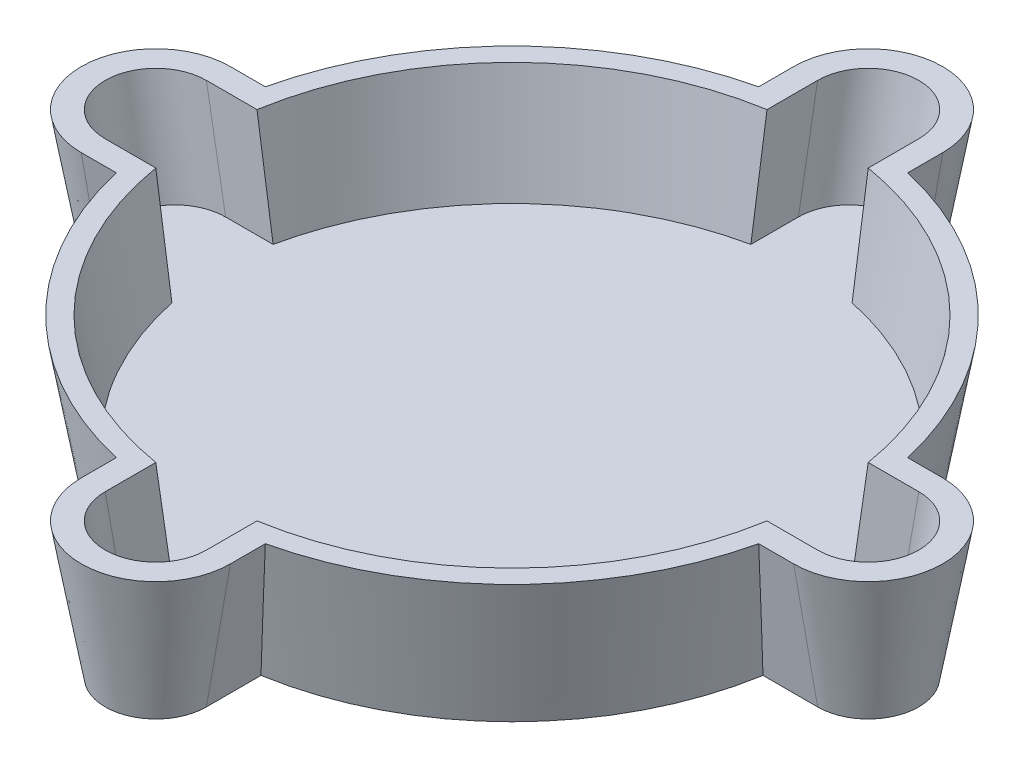
from build123d import *

# Parameters (mm, degrees)
EXTRUDE_THIN1_DEPTH = 10
EXTRUDE_THIN1_DRAFT = -10
BOSS_EXTRUDE1_DEPTH = 2
CUT_EXTRUDE1_DEPTH  = 8.123412895
CIRPATTERN1_COUNT   = 4
CUT_EXTRUDE2_DEPTH  = 8.123412895
CIRPATTERN2_COUNT   = 4


with BuildPart() as part:
    # Sketch1 → Extrude-Thin1 (with draft: the straight prism first)
    with BuildSketch(Plane(origin=(0, 0, 0), x_dir=(1, 0, 0), z_dir=(0, 1, 0))):
        with BuildLine():
            ThreePointArc((22.190349254, 3.72), (15.909902577, 15.909902577), (3.72, 22.190349254))
            Line((3.72, 22.190349254), (3.72, 26.21))
            ThreePointArc((3.72, 26.21), (0, 29.93), (-3.72, 26.21))
            Line((-3.72, 26.21), (-3.72, 22.190349254))
            ThreePointArc((-3.72, 22.190349254), (-15.909902577, 15.909902577), (-22.190349254, 3.72))
            Line((-22.190349254, 3.72), (-26.21, 3.72))
            ThreePointArc((-26.21, 3.72), (-29.93, 0), (-26.21, -3.72))
            Line((-26.21, -3.72), (-22.190349254, -3.72))
            ThreePointArc((-22.190349254, -3.72), (-15.909902577, -15.909902577), (-3.72, -22.190349254))
            Line((-3.72, -22.190349254), (-3.72, -26.21))
            ThreePointArc((-3.72, -26.21), (0, -29.93), (3.72, -26.21))
            Line((3.72, -26.21), (3.72, -22.190349254))
            ThreePointArc((3.72, -22.190349254), (15.909902577, -15.909902577), (22.190349254, -3.72))
            Line((22.190349254, -3.72), (26.21, -3.72))
            ThreePointArc((26.21, -3.72), (29.93, 0), (26.21, 3.72))
            Line((26.21, 3.72), (22.190349254, 3.72))
        make_face()
        with BuildLine():
            Line((20.909289801, 2.25), (26.21, 2.25))
            ThreePointArc((26.21, 2.25), (28.46, 0), (26.21, -2.25))
            Line((26.21, -2.25), (20.909289801, -2.25))
            ThreePointArc((20.909289801, -2.25), (14.870455608, -14.870455608), (2.25, -20.909289801))
            Line((2.25, -20.909289801), (2.25, -26.21))
            ThreePointArc((2.25, -26.21), (0, -28.46), (-2.25, -26.21))
            Line((-2.25, -26.21), (-2.25, -20.909289801))
            ThreePointArc((-2.25, -20.909289801), (-14.870455608, -14.870455608), (-20.909289801, -2.25))
            Line((-20.909289801, -2.25), (-26.21, -2.25))
            ThreePointArc((-26.21, -2.25), (-28.46, 0), (-26.21, 2.25))
            Line((-26.21, 2.25), (-20.909289801, 2.25))
            ThreePointArc((-20.909289801, 2.25), (-14.870455608, 14.870455608), (-2.25, 20.909289801))
            Line((-2.25, 20.909289801), (-2.25, 26.21))
            ThreePointArc((-2.25, 26.21), (0, 28.46), (2.25, 26.21))
            Line((2.25, 26.21), (2.25, 20.909289801))
            ThreePointArc((2.25, 20.909289801), (14.870455608, 14.870455608), (20.909289801, 2.25))
        make_face(mode=Mode.SUBTRACT)
    extrude(amount=EXTRUDE_THIN1_DEPTH)
    # Extrude-Thin1: the draft: its side faces are tilted about the plane it starts from
    extrude_thin1_sides = [part.faces().sort_by_distance(p)[0] for p in [
        (-3.72, 5, 24.200174627),
        (0, 5, 29.93),
        (3.72, 5, 24.200174627),
        (15.909902577, 5, 15.909902577),
        (24.200174627, 5, 3.72),
        (29.93, 5, 0),
        (24.200174627, 5, -3.72),
        (15.909902577, 5, -15.909902577),
        (3.72, 5, -24.200174627),
        (0, 5, -29.93),
        (-3.72, 5, -24.200174627),
        (-15.909902577, 5, -15.909902577),
        (-24.200174627, 5, -3.72),
        (-29.93, 5, 0),
        (-24.200174627, 5, 3.72),
        (-15.909902577, 5, 15.909902577),
        (-23.559644901, 5, 2.25),
        (-28.46, 5, 0),
        (-23.559644901, 5, -2.25),
        (-14.870455608, 5, -14.870455608),
        (-2.25, 5, -23.559644901),
        (0, 5, -28.46),
        (2.25, 5, -23.559644901),
        (14.870455608, 5, -14.870455608),
        (23.559644901, 5, -2.25),
        (28.46, 5, 0),
        (23.559644901, 5, 2.25),
        (14.870455608, 5, 14.870455608),
        (2.25, 5, 23.559644901),
        (0, 5, 28.46),
        (-2.25, 5, 23.559644901),
        (-14.870455608, 5, 14.870455608),
    ]]
    draft(extrude_thin1_sides, Plane(origin=(0, 0, 0), x_dir=(1, 0, 0), z_dir=(0, 1, 0)), EXTRUDE_THIN1_DRAFT)

    # Sketch2 → Boss-Extrude1 (add)
    with BuildSketch(Plane.XZ):
        with BuildLine():
            Line((3.72, -26.21), (3.72, -22.190349254))
            ThreePointArc((3.72, -22.190349254), (15.909902577, -15.909902577), (22.190349254, -3.72))
            Line((22.190349254, -3.72), (26.21, -3.72))
            ThreePointArc((26.21, -3.72), (29.93, 0), (26.21, 3.72))
            Line((26.21, 3.72), (22.190349254, 3.72))
            ThreePointArc((22.190349254, 3.72), (15.909902577, 15.909902577), (3.72, 22.190349254))
            Line((3.72, 22.190349254), (3.72, 26.21))
            ThreePointArc((3.72, 26.21), (0, 29.93), (-3.72, 26.21))
            Line((-3.72, 26.21), (-3.72, 22.190349254))
            ThreePointArc((-3.72, 22.190349254), (-15.909902577, 15.909902577), (-22.190349254, 3.72))
            Line((-22.190349254, 3.72), (-26.21, 3.72))
            ThreePointArc((-26.21, 3.72), (-29.93, 0), (-26.21, -3.72))
            Line((-26.21, -3.72), (-22.190349254, -3.72))
            ThreePointArc((-22.190349254, -3.72), (-15.909902577, -15.909902577), (-3.72, -22.190349254))
            Line((-3.72, -22.190349254), (-3.72, -26.21))
            ThreePointArc((-3.72, -26.21), (0, -29.93), (3.72, -26.21))
        make_face()
    extrude(amount=-BOSS_EXTRUDE1_DEPTH)

    # Sketch4 → Cut-Extrude1 (cut, along a direction that is not the sketch's normal)
    with BuildSketch(Plane(origin=(0, 10, 0), x_dir=(1, 0, 0), z_dir=(0, 1, 0))):
        with BuildLine():
            Line((26.21, 3.723269807), (18.903548722, 3.723269807))
            ThreePointArc((18.903548722, 3.723269807), (19.266730193, 0), (18.903548722, -3.723269807))
            Line((18.903548722, -3.723269807), (26.21, -3.723269807))
            ThreePointArc((26.21, -3.723269807), (29.933269807, 0), (26.21, 3.723269807))
        make_face()
    cut_extrude1 = extrude(amount=-CUT_EXTRUDE1_DEPTH, dir=(0.17364817766693075, 0.984807753012208, 0), mode=Mode.SUBTRACT)

    # CirPattern1: Cut-Extrude1 ×4 about axis
    cirpattern1_axis = Axis((0, 0, 0), (0, -1, 0))
    for i in range(1, CIRPATTERN1_COUNT):
        add(cut_extrude1.rotate(cirpattern1_axis, i * 360 / CIRPATTERN1_COUNT), mode=Mode.SUBTRACT)

    # Sketch7 → Cut-Extrude2 (cut, along a direction that is not the sketch's normal)
    with BuildSketch(Plane(origin=(0, 10, 0), x_dir=(1, 0, 0), z_dir=(0, 1, 0))):
        with BuildLine():
            Line((3.723269807, 18.903548722), (3.723269807, 22.487116544))
            ThreePointArc((3.723269807, 22.487116544), (16.117275646, 16.117275646), (22.487116544, 3.723269807))
            Line((22.487116544, 3.723269807), (18.903548722, 3.723269807))
            ThreePointArc((18.903548722, 3.723269807), (13.623635571, 13.623635571), (3.723269807, 18.903548722))
        make_face()
    cut_extrude2 = extrude(amount=-CUT_EXTRUDE2_DEPTH, dir=(0.12278780396897289, 0.9848077530122081, -0.12278780396897289), mode=Mode.SUBTRACT)

    # CirPattern2: Cut-Extrude2 ×4 about axis
    cirpattern2_axis = Axis((0, 0, 0), (0, -1, 0))
    for i in range(1, CIRPATTERN2_COUNT):
        add(cut_extrude2.rotate(cirpattern2_axis, i * 360 / CIRPATTERN2_COUNT), mode=Mode.SUBTRACT)


solid = part.part
